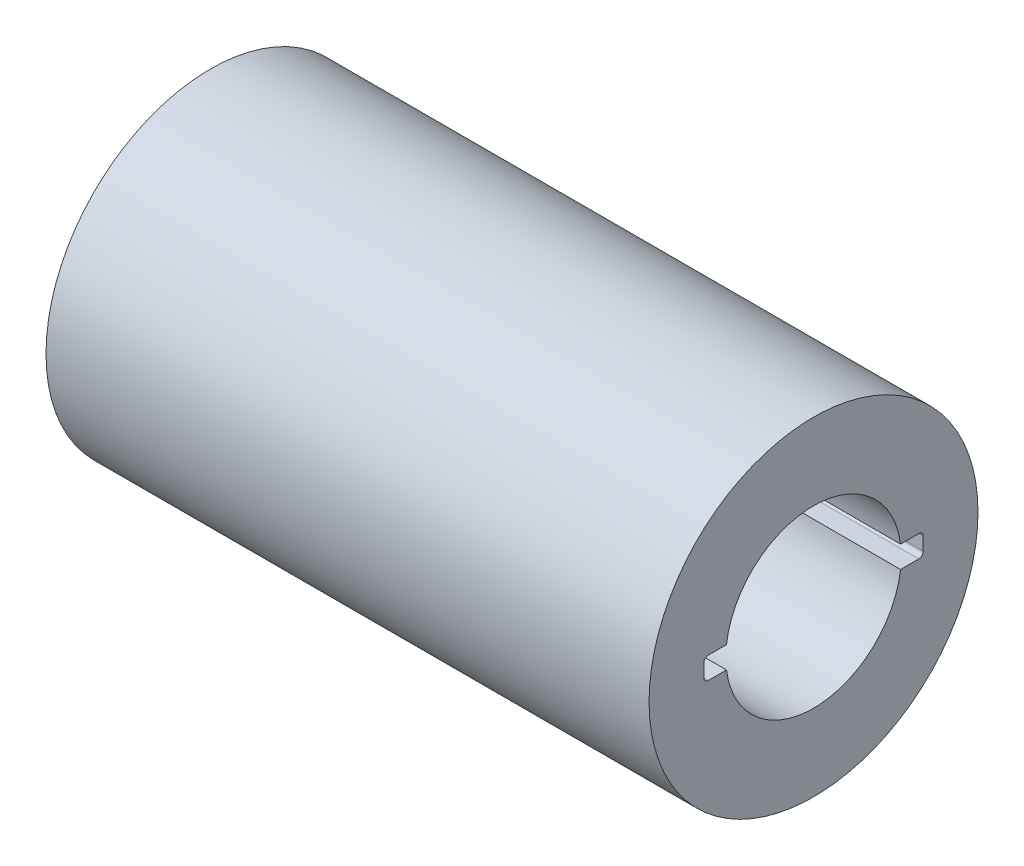
from build123d import *

# Parameters (mm, degrees)
SKETCH1_R            = 7.5
SKETCH1_R_2          = 4
SCREWSIDE_DEPTH      = 10
MOTORSIDE_START      = 17.5
SKETCH4_R            = 7.5
MOTORSIDE_DEPTH      = 17.5
SKETCH6_W            = 7
SKETCH6_H            = 1
ESCAPE_HOLES_DEPTH   = 30.474565306
SKETCH7_W            = 10
SKETCH7_H            = 1
ESCAPE_HOLES_2_DEPTH = 10
FILLET1_R            = 0.2
CUT_EXTRUDE3_DEPTH   = 22.277922831


with BuildPart() as part:
    # Sketch1 → ScrewSide (new body)
    with BuildSketch(Plane(origin=(0, 0, 0), x_dir=(0, 0, -1), z_dir=(1, 0, 0))):
        Circle(SKETCH1_R)
        Circle(SKETCH1_R_2, mode=Mode.SUBTRACT)
    extrude(amount=SCREWSIDE_DEPTH)

    # Sketch4 → MotorSide (add)
    with BuildSketch(Plane.ZY.offset(MOTORSIDE_START)):
        Circle(SKETCH4_R)
        with BuildLine():
            Line((-1.5, -2), (1.5, -2))
            ThreePointArc((1.5, -2), (0, 2.5), (-1.5, -2))
        make_face(mode=Mode.SUBTRACT)
    extrude(amount=-MOTORSIDE_DEPTH)

    # Sketch6 → Escape Holes (cut, through all)
    with BuildSketch(Plane.ZY.offset(17.5)):
        Rectangle(SKETCH6_W, SKETCH6_H)
    extrude(amount=-ESCAPE_HOLES_DEPTH, mode=Mode.SUBTRACT)

    # Sketch7 → Escape Holes 2 (cut)
    with BuildSketch(Plane(origin=(10, 0, 0), x_dir=(0, 0, -1), z_dir=(1, 0, 0))):
        Rectangle(SKETCH7_W, SKETCH7_H)
    extrude(amount=-ESCAPE_HOLES_2_DEPTH, mode=Mode.SUBTRACT)

    # Fillet1
    fillet1_edges = [part.edges().sort_by_distance(p)[0] for p in [
        (-8.75, 0.5, 3.5),
        (-8.75, -0.5, 3.5),
        (-8.75, -0.5, -3.5),
        (-8.75, 0.5, -3.5),
        (5, 0.5, 5),
        (5, -0.5, 5),
        (5, -0.5, -5),
        (5, 0.5, -5),
    ]]
    fillet(fillet1_edges, radius=FILLET1_R)

    # Sketch8 → Cut-Extrude3 (cut, through all)
    with BuildSketch(Plane(origin=(0, -2, 0), x_dir=(1, 0, 0), z_dir=(0, 1, 0))):
        with BuildLine():
            ThreePointArc((-6.45, 0), (-5, -1.45), (-3.55, 0))
            Line((-3.55, 0), (-6.45, 0))
        make_face()
        with BuildLine():
            Line((-6.45, 0), (-3.55, 0))
            ThreePointArc((-3.55, 0), (-5, 1.45), (-6.45, 0))
        make_face()
    extrude(amount=-CUT_EXTRUDE3_DEPTH, mode=Mode.SUBTRACT)


solid = part.part
